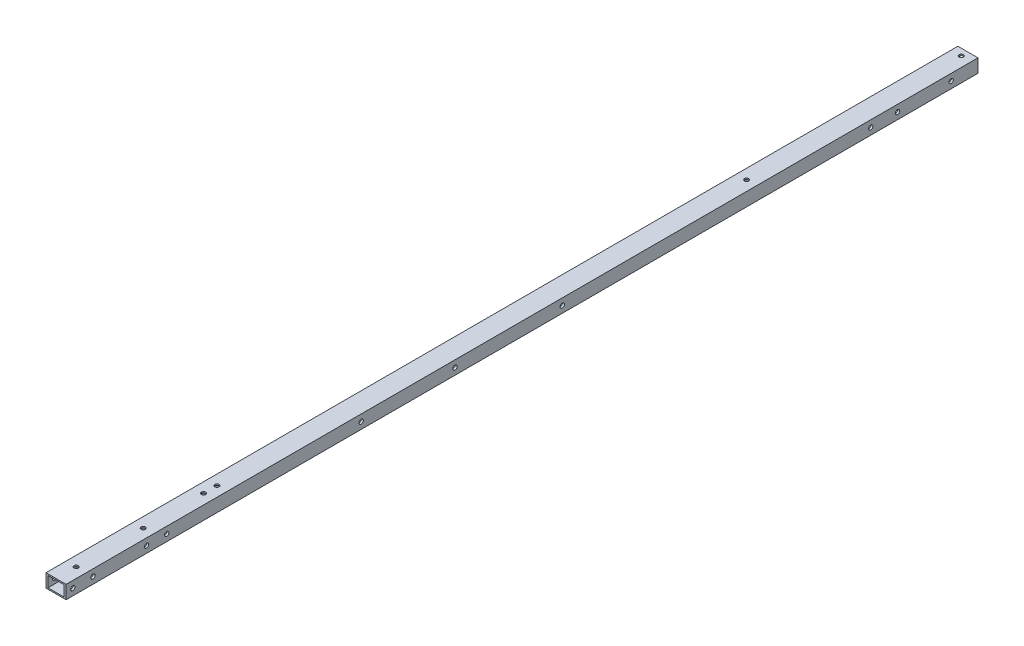
from build123d import *

# Parameters (mm, degrees)
SKETCH_1_W          = 15
SKETCH_1_H          = 10
SKETCH_1_W_2        = 12
SKETCH_1_H_2        = 8
EXTRUDE_1_DEPTH     = 40
SKETCH_2_R          = 1.6
CUT_EXTRUDE_1_DEPTH = 44.011626335
SKETCH_4_R          = 1.6
CUT_EXTRUDE_3_DEPTH = 44.011626335
SKETCH_5_R          = 1.6
CUT_EXTRUDE_4_DEPTH = 42.907636536
SKETCH_6_W          = 15
SKETCH_6_H          = 10
SKETCH_6_W_2        = 12
SKETCH_6_H_2        = 8
EXTRUDE_2_DEPTH     = 600
SKETCH_7_R          = 1.6
CUT_EXTRUDE_5_DEPTH = 641.122058673
SKETCH_8_R          = 1.6
CUT_EXTRUDE_6_DEPTH = 641.195282707


with BuildPart() as part:
    # ｽｹｯﾁ1 → ﾎﾞｽ - 押し出し1 (new body)
    with BuildSketch(Plane.XY):
        Rectangle(SKETCH_1_W, SKETCH_1_H)
        Rectangle(SKETCH_1_W_2, SKETCH_1_H_2, mode=Mode.SUBTRACT)
    extrude_1 = extrude(amount=EXTRUDE_1_DEPTH)

    # ｽｹｯﾁ2 → ｶｯﾄ - 押し出し1 (cut, through all)
    with BuildSketch(Plane(origin=(7.5, 0, 0), x_dir=(0, 0, -1), z_dir=(1, 0, 0))):
        with Locations((-20, 0)):
            Circle(SKETCH_2_R)
    cut_extrude_1 = extrude(amount=-CUT_EXTRUDE_1_DEPTH, mode=Mode.SUBTRACT)

    # ｽｹｯﾁ4 → ｶｯﾄ - 押し出し3 (cut, through all)
    with BuildSketch(Plane.ZY.offset(7.5)):
        with Locations((35, 0)):
            Circle(SKETCH_4_R)
    cut_extrude_3 = extrude(amount=-CUT_EXTRUDE_3_DEPTH, mode=Mode.SUBTRACT)

    # ｽｹｯﾁ5 → ｶｯﾄ - 押し出し4 (cut, through all)
    with BuildSketch(Plane(origin=(0, 5, 0), x_dir=(1, 0, 0), z_dir=(0, 1, 0))):
        with Locations(Location((0, -25, 0), (0, 0, 270))):
            Circle(SKETCH_5_R)
    cut_extrude_4 = extrude(amount=-CUT_EXTRUDE_4_DEPTH, mode=Mode.SUBTRACT)

    # ﾐﾗｰ1: ﾎﾞｽ - 押し出し1, ｶｯﾄ - 押し出し1, ｶｯﾄ - 押し出し3, ｶｯﾄ - 押し出し4 across plane
    add(extrude_1.mirror(Plane(origin=(0, 0, 0), x_dir=(1, 0, 0), z_dir=(0, 0, -1))))
    add(cut_extrude_1.mirror(Plane(origin=(0, 0, 0), x_dir=(1, 0, 0), z_dir=(0, 0, -1))), mode=Mode.SUBTRACT)
    add(cut_extrude_3.mirror(Plane(origin=(0, 0, 0), x_dir=(1, 0, 0), z_dir=(0, 0, -1))), mode=Mode.SUBTRACT)
    add(cut_extrude_4.mirror(Plane(origin=(0, 0, 0), x_dir=(1, 0, 0), z_dir=(0, 0, -1))), mode=Mode.SUBTRACT)

    # ｽｹｯﾁ6 → ﾎﾞｽ - 押し出し2 (add)
    with BuildSketch(Plane(origin=(0, 0, -40), x_dir=(-1, 0, 0), z_dir=(0, 0, -1))):
        Rectangle(SKETCH_6_W, SKETCH_6_H)
        Rectangle(SKETCH_6_W_2, SKETCH_6_H_2, mode=Mode.SUBTRACT)
    extrude(amount=EXTRUDE_2_DEPTH)

    # ｽｹｯﾁ7 → ｶｯﾄ - 押し出し5 (cut, through all)
    with BuildSketch(Plane(origin=(0, -5, 0), x_dir=(-1, 0, 0), z_dir=(0, -1, 0))):
        with Locations(Location((0, 635, 0), (0, 0, 90))):
            Circle(SKETCH_7_R)
        with Locations(Location((0, 80, 0), (0, 0, 90))):
            Circle(SKETCH_7_R)
        with Locations(Location((0, 70, 0), (0, 0, 90))):
            Circle(SKETCH_7_R)
        with Locations(Location((0, 475, 0), (0, 0, 90))):
            Circle(SKETCH_7_R)
    extrude(amount=-CUT_EXTRUDE_5_DEPTH, mode=Mode.SUBTRACT)

    # ｽｹｯﾁ8 → ｶｯﾄ - 押し出し6 (cut, through all)
    with BuildSketch(Plane(origin=(7.5, 0, 0), x_dir=(0, 0, -1), z_dir=(1, 0, 0))):
        with Locations((330, 0)):
            Circle(SKETCH_8_R)
        with Locations((580, 0)):
            Circle(SKETCH_8_R)
        with Locations((180, 0)):
            Circle(SKETCH_8_R)
        with Locations((250, 0)):
            Circle(SKETCH_8_R)
        with Locations((560, 0)):
            Circle(SKETCH_8_R)
        with Locations((620, 0)):
            Circle(SKETCH_8_R)
    extrude(amount=-CUT_EXTRUDE_6_DEPTH, mode=Mode.SUBTRACT)


solid = part.part
